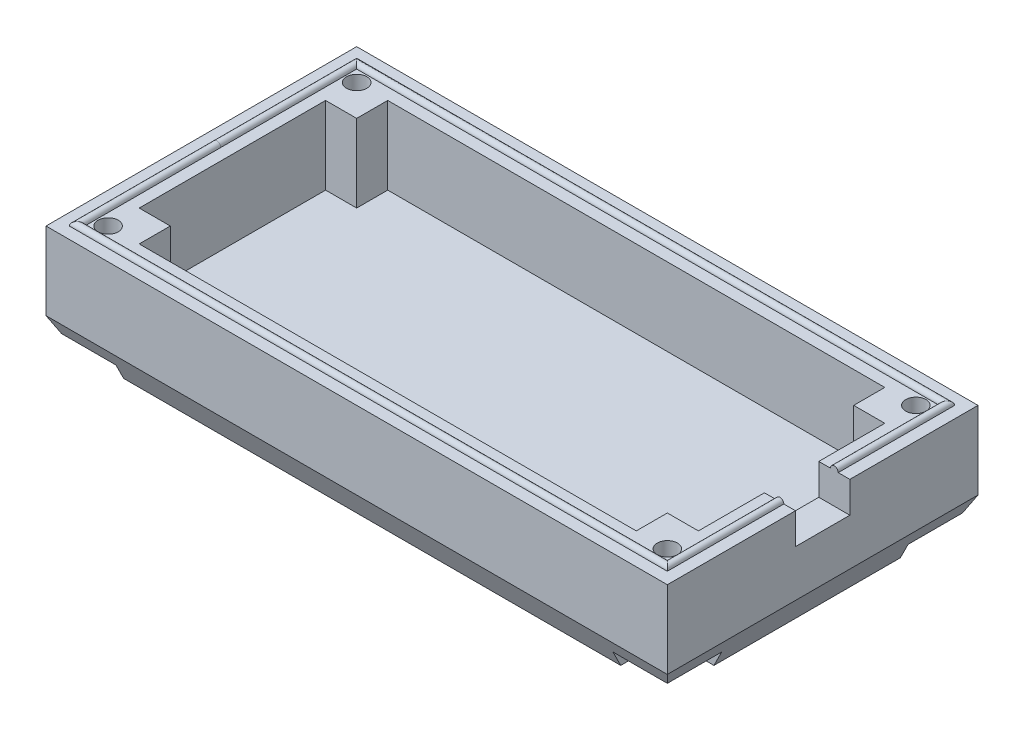
from build123d import *

# Parameters (mm, degrees)
SCHIZZO2_W                     = 40
SCHIZZO2_H                     = 20
ESTRUSIONE_ESTRUSIONE1_DEPTH   = 7
TAGLIO_ESTRUSIONE1_DEPTH       = 5
SMUSSO1_SIZE                   = 1
SMUSSO1_SIZE2                  = 2
SCHIZZO6_W                     = 4
SCHIZZO6_H                     = 4
TAGLIO_ESTRUSIONE2_DEPTH       = 1
FORO_PER_VITE_M1_1_D           = 1.3
FORO_PER_VITE_M1_1_CSINK_D     = 1.35
FORO_PER_VITE_M1_1_CSINK_ANGLE = 90
SPECCHIA2_COPY_1_D             = 1.3
SPECCHIA2_COPY_1_CSINK_D       = 1.35
SPECCHIA2_COPY_1_CSINK_ANGLE   = 90
TAGLIO_ESTRUSIONE3_DEPTH       = 42.821047333
TAGLIO_ESTRUSIONE3_DEPTH_BACK  = 3
SCHIZZO14_W                    = 3.5
SCHIZZO14_H                    = 4


with BuildPart() as part:
    # Schizzo2 → Estrusione-Estrusione1 (new body)
    with BuildSketch(Plane(origin=(0, 0, 0), x_dir=(1, 0, 0), z_dir=(0, 1, 0))):
        Rectangle(SCHIZZO2_W, SCHIZZO2_H)
    extrude(amount=-ESTRUSIONE_ESTRUSIONE1_DEPTH)

    # Schizzo3 → Taglio-Estrusione1 (cut)
    with BuildSketch(Plane(origin=(0, 0, 0), x_dir=(1, 0, 0), z_dir=(0, 1, 0))):
        Polygon((-16, 8), (16, 8), (16, 6), (18, 6), (18, -6), (16, -6), (16, -8), (-16, -8), (-16, -6), (-18, -6), (-18, 6), (-16, 6), align=None)
    extrude(amount=-TAGLIO_ESTRUSIONE1_DEPTH, mode=Mode.SUBTRACT)

    # Sweep1: sweep along a path in Schizzo5
    with BuildLine(Plane(origin=(0, 0, 0), x_dir=(1, 0, 0), z_dir=(0, 1, 0))) as sweep1_path:
        Line((19, -9), (-19, -9))
        Line((-19, -9), (-19, 9))
        Line((-19, 9), (19, 9))
        Line((19, 9), (19, -9))
    # Schizzo4 → Sweep1 (sweep)
    with BuildSketch(Plane.XY):
        with BuildLine():
            Line((-18.75, 0), (-19.25, 0))
            ThreePointArc((-19.25, 0), (-19, 0.25), (-18.75, 0))
        make_face()
    sweep(path=sweep1_path.line, transition=Transition.RIGHT)

    # Smusso1
    smusso1_edges = [part.edges().sort_by_distance(p)[0] for p in [
        (20, -7, 0),
        (0, -7, -10),
        (-20, -7, 0),
        (0, -7, 10),
    ]]
    smusso1_side = [part.faces().sort_by_distance(p)[0] for p in [
        (0, -7, 0),
    ]]
    chamfer(smusso1_edges, length=SMUSSO1_SIZE, length2=SMUSSO1_SIZE2, reference=smusso1_side[0])

    # Schizzo6 → Taglio-Estrusione2 (cut)
    with BuildSketch(Plane.XZ.offset(7)):
        with Locations((-18, 8)):
            Rectangle(SCHIZZO6_W, SCHIZZO6_H)
        with Locations((18, 8)):
            Rectangle(SCHIZZO6_W, SCHIZZO6_H)
        with Locations((18, -8)):
            Rectangle(SCHIZZO6_W, SCHIZZO6_H)
        with Locations((-18, -8)):
            Rectangle(SCHIZZO6_W, SCHIZZO6_H)
    extrude(amount=-TAGLIO_ESTRUSIONE2_DEPTH, mode=Mode.SUBTRACT)

    # Foro per Vite M1-1 (through all)
    with Locations(Plane(origin=(0, -6, 0), x_dir=(-1, 0, 0), z_dir=(0, -1, 0))):
        with Locations((-18, 8)):
            foro_per_vite_m1_1 = CounterSinkHole(FORO_PER_VITE_M1_1_D / 2, FORO_PER_VITE_M1_1_CSINK_D / 2, counter_sink_angle=FORO_PER_VITE_M1_1_CSINK_ANGLE)

    # Specchia1: Foro per Vite M1-1 across plane
    add(foro_per_vite_m1_1.mirror(Plane(origin=(0, 0, 0), x_dir=(0, 0, 1), z_dir=(1, 0, 0))), mode=Mode.SUBTRACT)

    # Specchia2: Foro per Vite M1-1 across plane
    add(foro_per_vite_m1_1.mirror(Plane.XY), mode=Mode.SUBTRACT)

    # Specchia2 copy 1 (through all)
    with Locations(Plane.XZ.offset(6)):
        with Locations((-18, 8)):
            CounterSinkHole(SPECCHIA2_COPY_1_D / 2, SPECCHIA2_COPY_1_CSINK_D / 2, counter_sink_angle=SPECCHIA2_COPY_1_CSINK_ANGLE)

    # Schizzo14 → Taglio-Estrusione3 (cut, two sides: drawn at the far end of the back side and taken through both)
    with BuildSketch(Plane(origin=(20, 0, 0), x_dir=(0, 0, -1), z_dir=(1, 0, 0)).offset(-TAGLIO_ESTRUSIONE3_DEPTH_BACK)):
        Rectangle(SCHIZZO14_W, SCHIZZO14_H)
    extrude(amount=TAGLIO_ESTRUSIONE3_DEPTH + TAGLIO_ESTRUSIONE3_DEPTH_BACK, mode=Mode.SUBTRACT)


solid = part.part
